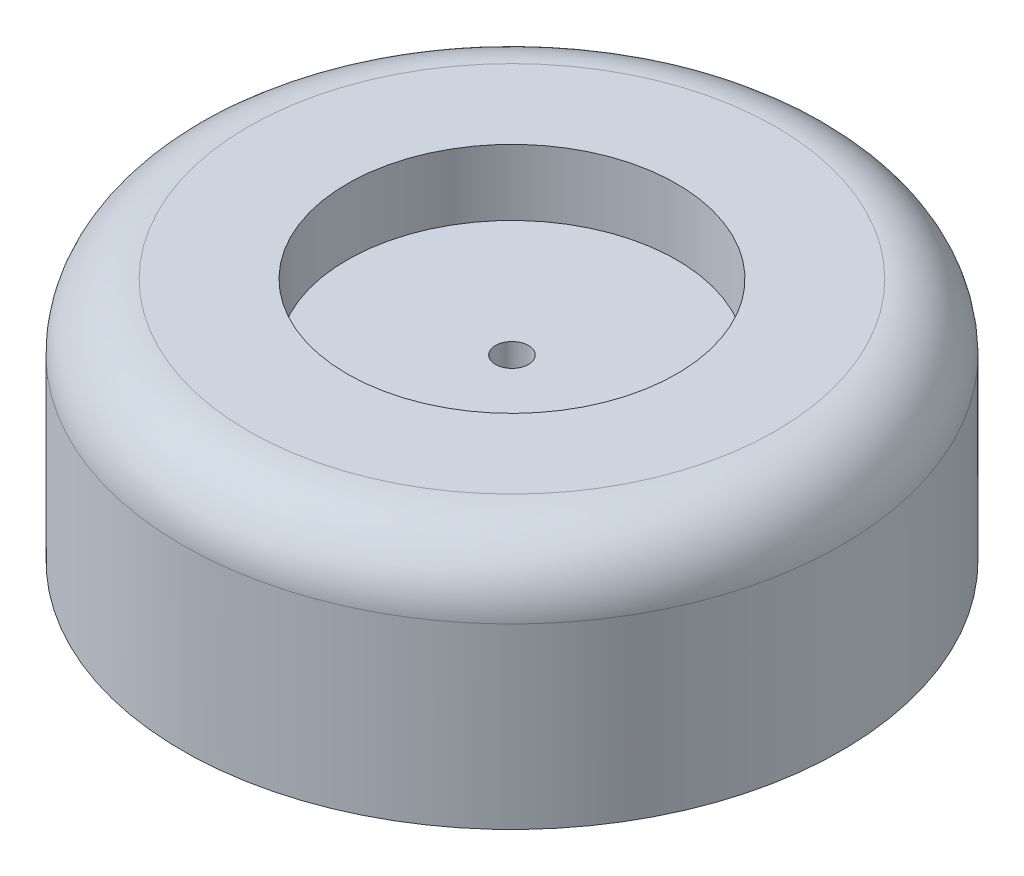
from build123d import *

# Parameters (mm, degrees)
SKETCH1_R               = 50
SKETCH1_R_2             = 47.5
BOSS_EXTRUDE1_DEPTH     = 10
SKETCH2_R               = 50
BOSS_EXTRUDE2_DEPTH     = 30
SKETCH4_R               = 2.5
SKETCH6_R               = 50
CUT_EXTRUDE2_DEPTH      = 3
CUT_EXTRUDE3_DEPTH      = 80.806014811
CUT_EXTRUDE3_DEPTH_BACK = 80.806014811
SKETCH7_R               = 2.5
FILLET1_R               = 10
SKETCH9_R               = 25
CUT_EXTRUDE5_DEPTH      = 10


with BuildPart() as part:
    # Sketch1 → Boss-Extrude1 (new body)
    with BuildSketch(Plane(origin=(0, 0, 0), x_dir=(1, 0, 0), z_dir=(0, 1, 0))):
        with Locations(Location((0, 0, 0), (0, 0, 270))):
            Circle(SKETCH1_R)
        with Locations(Location((0, 0, 0), (0, 0, 270))):
            Circle(SKETCH1_R_2, mode=Mode.SUBTRACT)
    extrude(amount=BOSS_EXTRUDE1_DEPTH)

    # Sketch2 → Boss-Extrude2 (add)
    with BuildSketch(Plane(origin=(0, 10, 0), x_dir=(1, 0, 0), z_dir=(0, 1, 0))):
        with Locations(Location((0, 0, 0), (0, 0, 270))):
            Circle(SKETCH2_R)
    extrude(amount=BOSS_EXTRUDE2_DEPTH)

    # Cut-Sweep1: sweep along a path in Sketch3
    with BuildLine(Plane.XZ.offset(-10)) as cut_sweep1_path:
        CenterArc((0, 0), 42.5, 0, 360)
    # Sketch4 → Cut-Sweep1 (sweep, cut)
    with BuildSketch(Plane.XY):
        with Locations((42.5, 10)):
            Circle(SKETCH4_R)
    sweep(path=cut_sweep1_path.line, mode=Mode.SUBTRACT)

    # Sketch6 → Cut-Extrude2 (cut)
    with BuildSketch(Plane.XZ):
        with Locations(Location((0, 0, 0), (0, 0, 270))):
            Circle(SKETCH6_R)
    extrude(amount=-CUT_EXTRUDE2_DEPTH, mode=Mode.SUBTRACT)

    # Sketch7 → Cut-Extrude3 (cut, two sides: drawn at the far end of the back side and taken through both)
    with BuildSketch(Plane(origin=(0, 40, 0), x_dir=(1, 0, 0), z_dir=(0, 1, 0)).offset(-CUT_EXTRUDE3_DEPTH_BACK)):
        with Locations(Location((0, 0, 0), (0, 0, 270))):
            Circle(SKETCH7_R)
    extrude(amount=CUT_EXTRUDE3_DEPTH + CUT_EXTRUDE3_DEPTH_BACK, mode=Mode.SUBTRACT)

    # Fillet1
    fillet1_edges = [part.edges().sort_by_distance(p)[0] for p in [
        (0, 40, -50),
    ]]
    fillet(fillet1_edges, radius=FILLET1_R)

    # Sketch9 → Cut-Extrude5 (cut)
    with BuildSketch(Plane(origin=(0, 40, 0), x_dir=(1, 0, 0), z_dir=(0, 1, 0))):
        with Locations(Location((0, 0, 0), (0, 0, 270))):
            Circle(SKETCH9_R)
    extrude(amount=-CUT_EXTRUDE5_DEPTH, mode=Mode.SUBTRACT)


solid = part.part
